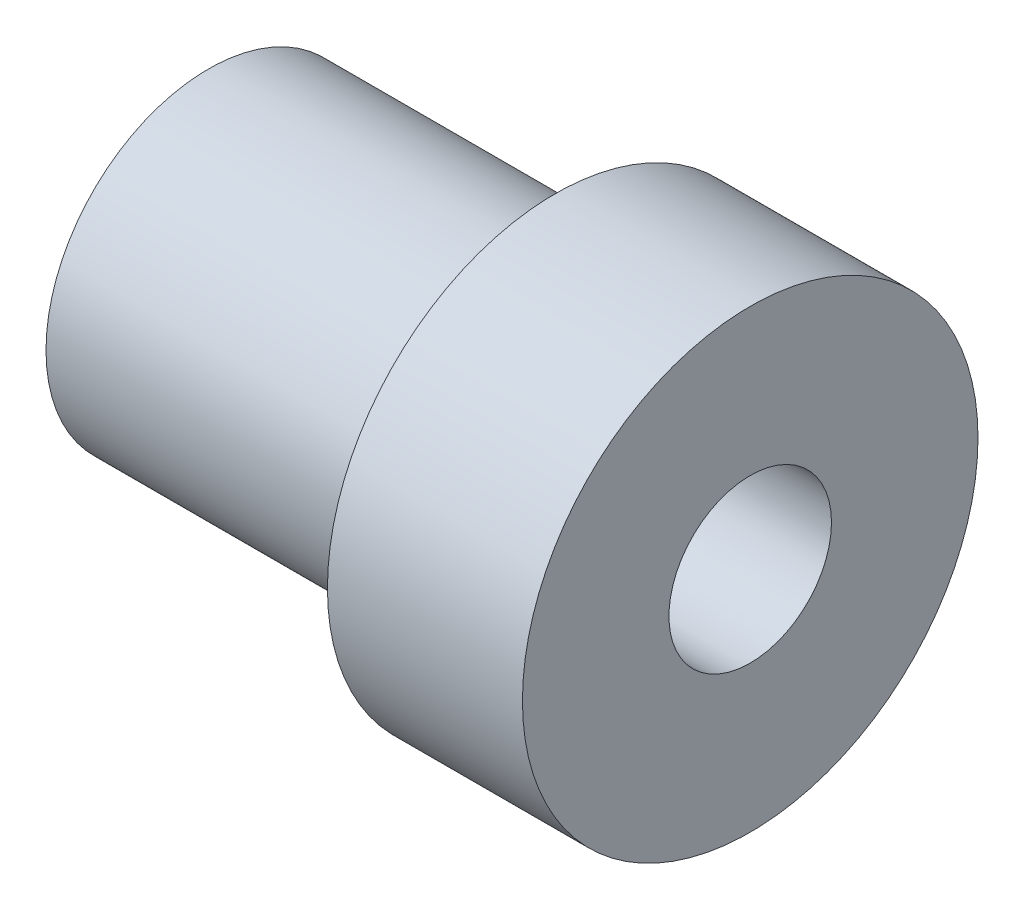
from build123d import *

# Parameters (mm, degrees)
SKETCH1_R                           = 3.96875
BOSS_EXTRUDE1_DEPTH                 = 8.466666667
SKETCH2_R                           = 5.5626
BOSS_EXTRUDE2_DEPTH                 = 4.7625
F_5_32_0_15625_DIAMETER_HOLE1_D     = 3.96875
F_5_32_0_15625_DIAMETER_HOLE1_DEPTH = 70.104
F_5_32_0_15625_DIAMETER_HOLE1_TIP   = 1.192332791


with BuildPart() as part:
    # Sketch1 → Boss-Extrude1 (new body)
    with BuildSketch(Plane(origin=(0, 0, 0), x_dir=(0, 0, -1), z_dir=(1, 0, 0))):
        Circle(SKETCH1_R)
    extrude(amount=BOSS_EXTRUDE1_DEPTH)

    # Sketch2 → Boss-Extrude2 (add)
    with BuildSketch(Plane(origin=(8.466666667, 0, 0), x_dir=(0, 0, -1), z_dir=(1, 0, 0))):
        with Locations(Location((0, 0, 0), (0, 0, 180))):
            Circle(SKETCH2_R)
    extrude(amount=BOSS_EXTRUDE2_DEPTH)

    # 5/32 (0.15625) Diameter Hole1
    with Locations(Plane(origin=(13.229166667, 0, 0), x_dir=(0, 0, -1), z_dir=(1, 0, 0))):
        with Locations((0, 0)):
            Hole(F_5_32_0_15625_DIAMETER_HOLE1_D / 2, depth=F_5_32_0_15625_DIAMETER_HOLE1_DEPTH)
            with Locations((0, 0, -(F_5_32_0_15625_DIAMETER_HOLE1_DEPTH + F_5_32_0_15625_DIAMETER_HOLE1_TIP / 2))):  # 118° drill point
                Cone(0, F_5_32_0_15625_DIAMETER_HOLE1_D / 2, F_5_32_0_15625_DIAMETER_HOLE1_TIP, mode=Mode.SUBTRACT)


solid = part.part
